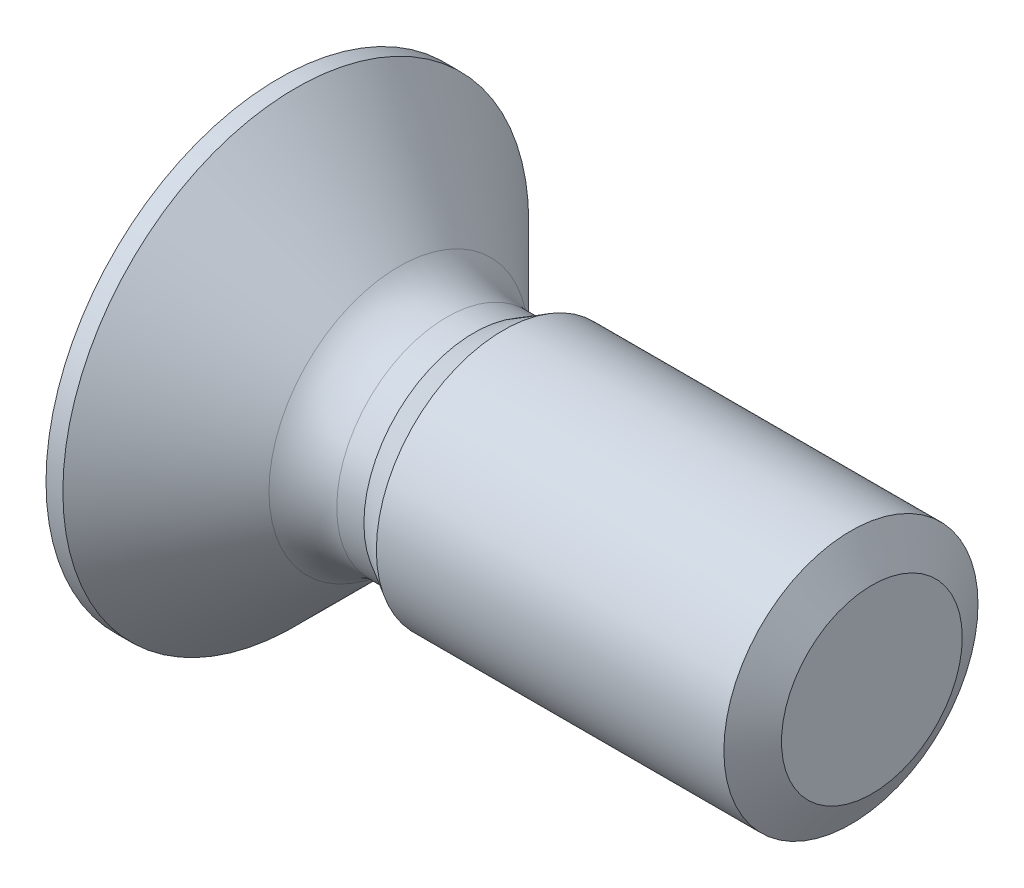
from build123d import *

# Parameters (mm, degrees)
PATTERN_CIRCULAR_1_COUNT = 2
PATTERN_CIRCULAR_1_ANGLE = 90


with BuildPart() as part:
    # 草图1 → Revolve 694 (revolve)
    with BuildSketch(Plane.XY, mode=Mode.PRIVATE) as revolve_694_sk:
        with BuildLine():
            Line((0, 0), (0, 2.75))
            Line((0, 2.75), (0.199, 2.75))
            Line((0.199, 2.75), (1.415685425, 1.533314575))
            ThreePointArc((1.415685425, 1.533314575), (1.675224104, 1.359896374), (1.98137085, 1.299))
            Line((1.98137085, 1.299), (2.301857788, 1.299))
            Line((2.301857788, 1.299), (2.65, 1.5))
            Line((2.65, 1.5), (7, 1.5))
            Line((7, 1.5), (7, 0))
            Line((7, 0), (0, 0))
        make_face()
    revolve(revolve_694_sk.sketch.rotate(Axis((0, 0, 0), (1, 0, 0)), 90), axis=Axis((0, 0, 0), (1, 0, 0)))

    # 草图2 → 切除-旋转1 (revolve, cut)
    with BuildSketch(Plane.XY, mode=Mode.PRIVATE) as cut_revolve_1_sk:
        Polygon((6.752708003, 1.5), (7.252708003, 1.5), (7, 1.067), align=None)
    revolve(cut_revolve_1_sk.sketch.rotate(Axis((0, 0, 0), (-1, 0, 0)), 270), axis=Axis((0, 0, 0), (-1, 0, 0)), mode=Mode.SUBTRACT)

    # 草图3 → 切除-放样1 section 0
    with BuildSketch(Plane.ZY, mode=Mode.PRIVATE) as loft_1_s0:
        with BuildLine():
            Line((-1.6, 0.25), (1.6, 0.25))
            Line((1.6, 0.25), (1.6, -0.25))
            Line((1.6, -0.25), (-1.6, -0.25))
            Line((-1.6, -0.25), (-1.6, 0.25))
        make_face()
    loft_1 = loft([loft_1_s0.sketch, Vertex(2.1, 0, 0)], mode=Mode.SUBTRACT)

    # 阵列(圆周)1: 切除-放样1 ×2 about axis
    pattern_circular_1_axis = Axis((0, 0, 0), (1, 0, 0))
    for i in range(1, PATTERN_CIRCULAR_1_COUNT):
        add(loft_1.rotate(pattern_circular_1_axis, i * PATTERN_CIRCULAR_1_ANGLE / (PATTERN_CIRCULAR_1_COUNT - 1)), mode=Mode.SUBTRACT)


solid = part.part
